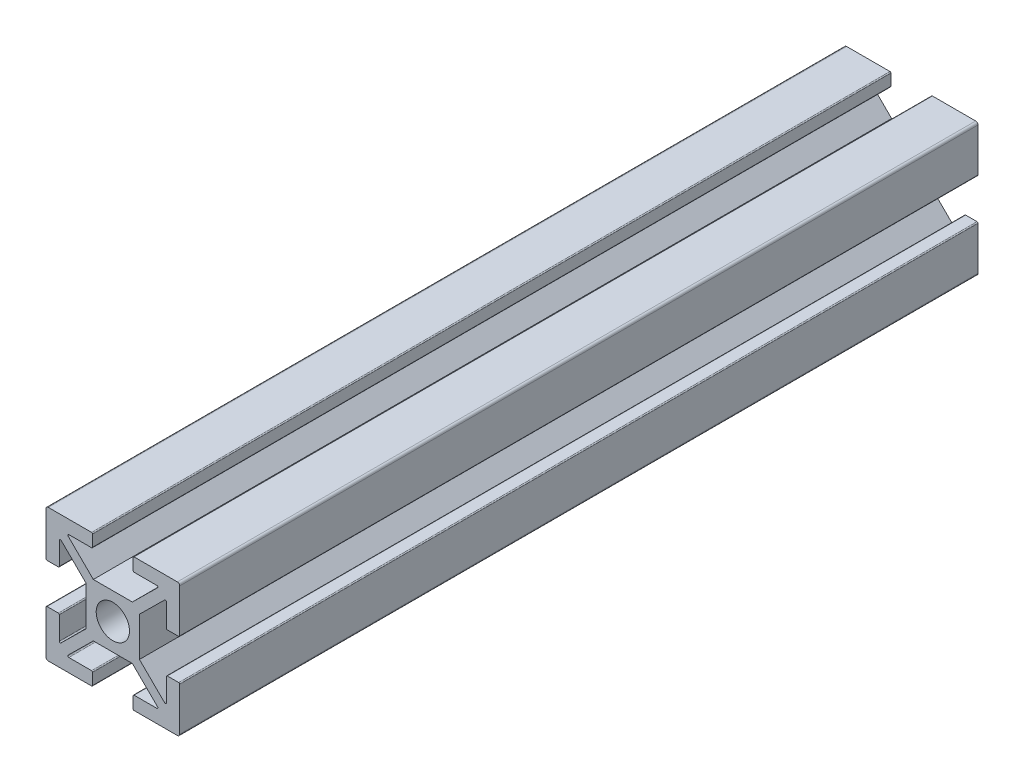
from build123d import *

# Parameters (mm, degrees)
SKETCH1_R           = 2.5
BOSS_EXTRUDE1_DEPTH = 120


with BuildPart() as part:
    # Sketch1 → Boss-Extrude1 (new body)
    with BuildSketch(Plane.XY):
        with BuildLine():
            Line((-7.427382464, 2.155691805), (-5.727382464, 2.155691805))
            ThreePointArc((-5.727382464, 2.155691805), (-5.621316447, 2.199625788), (-5.577382464, 2.305691805))
            Line((-5.577382464, 2.305691805), (-5.577382464, 5.741876319))
            ThreePointArc((-5.577382464, 5.741876319), (-5.485183419, 5.880292537), (-5.321928469, 5.848550846))
            Line((-5.321928469, 5.848550846), (-1.531086168, 2.101082027))
            Line((-1.531086168, 2.101082027), (-1.531086168, -3.789698417))
            Line((-1.531086168, -3.789698417), (-5.321928469, -7.537167236))
            ThreePointArc((-5.321928469, -7.537167236), (-5.485183419, -7.568908927), (-5.577382464, -7.430492708))
            Line((-5.577382464, -7.430492708), (-5.577382464, -3.994308195))
            ThreePointArc((-5.577382464, -3.994308195), (-5.621316447, -3.888242178), (-5.727382464, -3.844308195))
            Line((-5.727382464, -3.844308195), (-7.427382464, -3.844308195))
            ThreePointArc((-7.427382464, -3.844308195), (-7.533448481, -3.888242178), (-7.577382464, -3.994308195))
            Line((-7.577382464, -3.994308195), (-7.577382464, -10.494308195))
            ThreePointArc((-7.577382464, -10.494308195), (-7.474869837, -10.741795568), (-7.227382464, -10.844308195))
            Line((-7.227382464, -10.844308195), (-0.727382464, -10.844308195))
            ThreePointArc((-0.727382464, -10.844308195), (-0.621316447, -10.800374212), (-0.577382464, -10.694308195))
            Line((-0.577382464, -10.694308195), (-0.577382464, -8.994308195))
            ThreePointArc((-0.577382464, -8.994308195), (-0.621316447, -8.888242178), (-0.727382464, -8.844308195))
            Line((-0.727382464, -8.844308195), (-4.145467261, -8.844308195))
            ThreePointArc((-4.145467261, -8.844308195), (-4.284213755, -8.751311795), (-4.250921257, -8.587633667))
            Line((-4.250921257, -8.587633667), (-0.464270258, -4.844308195))
            Line((-0.464270258, -4.844308195), (5.402097922, -4.844308195))
            Line((5.402097922, -4.844308195), (9.188748921, -8.587633667))
            ThreePointArc((9.188748921, -8.587633667), (9.22204142, -8.751311795), (9.083294926, -8.844308195))
            Line((9.083294926, -8.844308195), (5.665210129, -8.844308195))
            ThreePointArc((5.665210129, -8.844308195), (5.559144111, -8.888242178), (5.515210129, -8.994308195))
            Line((5.515210129, -8.994308195), (5.515210129, -10.694308195))
            ThreePointArc((5.515210129, -10.694308195), (5.559144111, -10.800374212), (5.665210129, -10.844308195))
            Line((5.665210129, -10.844308195), (12.165210129, -10.844308195))
            ThreePointArc((12.165210129, -10.844308195), (12.412697502, -10.741795568), (12.515210129, -10.494308195))
            Line((12.515210129, -10.494308195), (12.515210129, -3.994308195))
            ThreePointArc((12.515210129, -3.994308195), (12.471276146, -3.888242178), (12.365210129, -3.844308195))
            Line((12.365210129, -3.844308195), (10.665210129, -3.844308195))
            ThreePointArc((10.665210129, -3.844308195), (10.559144111, -3.888242178), (10.515210129, -3.994308195))
            Line((10.515210129, -3.994308195), (10.515210129, -7.430492708))
            ThreePointArc((10.515210129, -7.430492708), (10.423011083, -7.568908927), (10.259756133, -7.537167236))
            Line((10.259756133, -7.537167236), (6.468913832, -3.789698417))
            Line((6.468913832, -3.789698417), (6.468913832, 2.101082027))
            Line((6.468913832, 2.101082027), (10.259756133, 5.848550846))
            ThreePointArc((10.259756133, 5.848550846), (10.423011083, 5.880292537), (10.515210129, 5.741876319))
            Line((10.515210129, 5.741876319), (10.515210129, 2.305691805))
            ThreePointArc((10.515210129, 2.305691805), (10.559144111, 2.199625788), (10.665210129, 2.155691805))
            Line((10.665210129, 2.155691805), (12.365210129, 2.155691805))
            ThreePointArc((12.365210129, 2.155691805), (12.471276146, 2.199625788), (12.515210129, 2.305691805))
            Line((12.515210129, 2.305691805), (12.515210129, 8.805691805))
            ThreePointArc((12.515210129, 8.805691805), (12.412697502, 9.053179179), (12.165210129, 9.155691805))
            Line((12.165210129, 9.155691805), (5.665210129, 9.155691805))
            ThreePointArc((5.665210129, 9.155691805), (5.559144111, 9.111757822), (5.515210129, 9.005691805))
            Line((5.515210129, 9.005691805), (5.515210129, 7.305691805))
            ThreePointArc((5.515210129, 7.305691805), (5.559144111, 7.199625788), (5.665210129, 7.155691805))
            Line((5.665210129, 7.155691805), (9.083294926, 7.155691805))
            ThreePointArc((9.083294926, 7.155691805), (9.22204142, 7.062695405), (9.188748921, 6.899017277))
            Line((9.188748921, 6.899017277), (5.402097922, 3.155691805))
            Line((5.402097922, 3.155691805), (-0.464270258, 3.155691805))
            Line((-0.464270258, 3.155691805), (-4.250921257, 6.899017277))
            ThreePointArc((-4.250921257, 6.899017277), (-4.284213755, 7.062695405), (-4.145467261, 7.155691805))
            Line((-4.145467261, 7.155691805), (-0.727382464, 7.155691805))
            ThreePointArc((-0.727382464, 7.155691805), (-0.621316447, 7.199625788), (-0.577382464, 7.305691805))
            Line((-0.577382464, 7.305691805), (-0.577382464, 9.005691805))
            ThreePointArc((-0.577382464, 9.005691805), (-0.621316447, 9.111757822), (-0.727382464, 9.155691805))
            Line((-0.727382464, 9.155691805), (-7.227382464, 9.155691805))
            ThreePointArc((-7.227382464, 9.155691805), (-7.474869837, 9.053179179), (-7.577382464, 8.805691805))
            Line((-7.577382464, 8.805691805), (-7.577382464, 2.305691805))
            ThreePointArc((-7.577382464, 2.305691805), (-7.533448481, 2.199625788), (-7.427382464, 2.155691805))
        make_face()
        with Locations((2.468913832, -0.844308195)):
            Circle(SKETCH1_R, mode=Mode.SUBTRACT)
    extrude(amount=BOSS_EXTRUDE1_DEPTH)


solid = part.part
